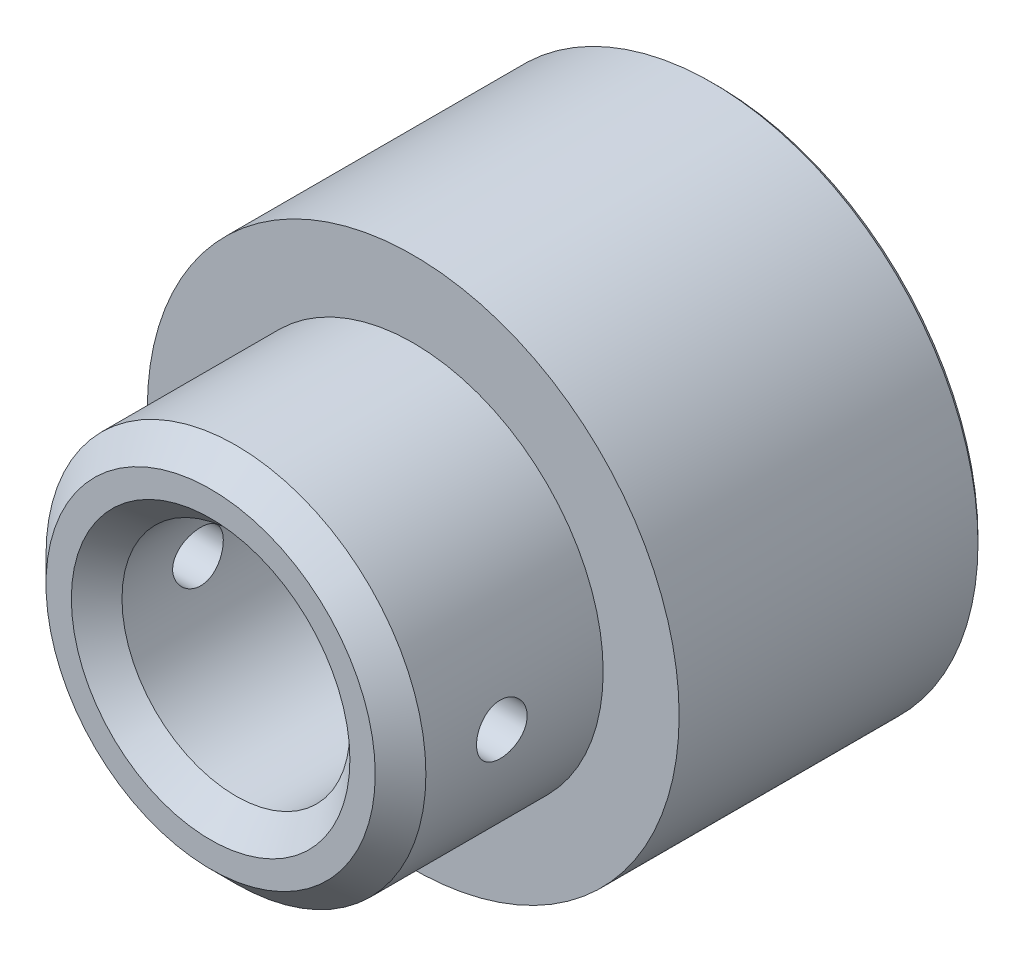
from build123d import *

# Parameters (mm, degrees)
SKETCH_1_R               = 52.5
EXTRUDE_1_DEPTH          = 60
SKETCH_2_R               = 37.5
EXTRUDE_2_DEPTH          = 40
SKETCH_3_R               = 42.5
CUT_EXTRUDE_1_DEPTH      = 40
SKETCH_4_R               = 22.5
CUT_EXTRUDE_2_DEPTH      = 125.549187071
CHAMFER_1_SIZE           = 1
CUT_EXTRUDE_3_DEPTH      = 125.549187071
CUT_EXTRUDE_3_DEPTH_BACK = 125.549187071
SKETCH_5_R               = 5
CHAMFER_2_SIZE           = 5


with BuildPart() as part:
    # Эскиз1 → Бобышка-Вытянуть1 (new body)
    with BuildSketch(Plane.XY):
        Circle(SKETCH_1_R)
    extrude(amount=EXTRUDE_1_DEPTH)

    # Эскиз2 → Бобышка-Вытянуть2 (add)
    with BuildSketch(Plane.XY.offset(60)):
        Circle(SKETCH_2_R)
    extrude(amount=EXTRUDE_2_DEPTH)

    # Эскиз3 → Вырез-Вытянуть1 (cut)
    with BuildSketch(Plane(origin=(0, 0, 0), x_dir=(-1, 0, 0), z_dir=(0, 0, -1))):
        Circle(SKETCH_3_R)
    extrude(amount=-CUT_EXTRUDE_1_DEPTH, mode=Mode.SUBTRACT)

    # Эскиз4 → Вырез-Вытянуть2 (cut, through all)
    with BuildSketch(Plane.XY.offset(100)):
        Circle(SKETCH_4_R)
    extrude(amount=-CUT_EXTRUDE_2_DEPTH, mode=Mode.SUBTRACT)

    # Фаска1
    chamfer_1_edges = [part.edges().sort_by_distance(p)[0] for p in [
        (42.5, 0, 0),
        (-52.5, 0, 0),
    ]]
    chamfer(chamfer_1_edges, length=CHAMFER_1_SIZE)

    # Эскиз5 → Вырез-Вытянуть3 (cut, two sides: drawn at the far end of the back side and taken through both)
    with BuildSketch(Plane(origin=(0, 0, 0), x_dir=(0, 0, -1), z_dir=(1, 0, 0)).offset(-CUT_EXTRUDE_3_DEPTH_BACK)):
        with Locations((-80, 0)):
            Circle(SKETCH_5_R)
    extrude(amount=CUT_EXTRUDE_3_DEPTH + CUT_EXTRUDE_3_DEPTH_BACK, mode=Mode.SUBTRACT)

    # Фаска2
    chamfer_2_edges = [part.edges().sort_by_distance(p)[0] for p in [
        (-22.5, 0, 100),
        (-37.5, 0, 100),
    ]]
    chamfer(chamfer_2_edges, length=CHAMFER_2_SIZE)


solid = part.part
